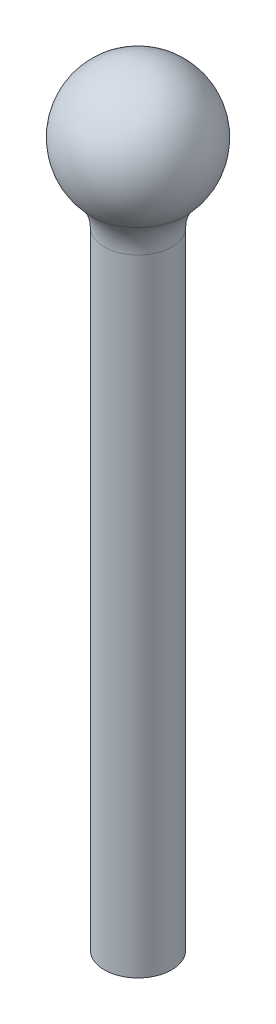
from build123d import *


with BuildPart() as part:
    # Sketch1 → Revolve1 (revolve)
    with BuildSketch(Plane.XY, mode=Mode.PRIVATE) as revolve1_sk:
        with BuildLine():
            Line((0, 6.75), (0, -18.25))
            Line((0, -18.25), (1.25, -18.25))
            Line((1.25, -18.25), (1.25, -73.25))
            Line((1.25, -73.25), (3.5, -73.25))
            Line((3.5, -73.25), (3.5, -8.11249037))
            ThreePointArc((3.5, -8.11249037), (3.858604392, -6.253069275), (4.882978723, -4.660366808))
            ThreePointArc((4.882978723, -4.660366808), (6.205641625, 2.655656609), (0, 6.75))
        make_face()
    revolve(revolve1_sk.sketch.rotate(Axis((0, 6.75, 0), (0, -1, 0)), 180), axis=Axis((0, 6.75, 0), (0, -1, 0)))


solid = part.part
